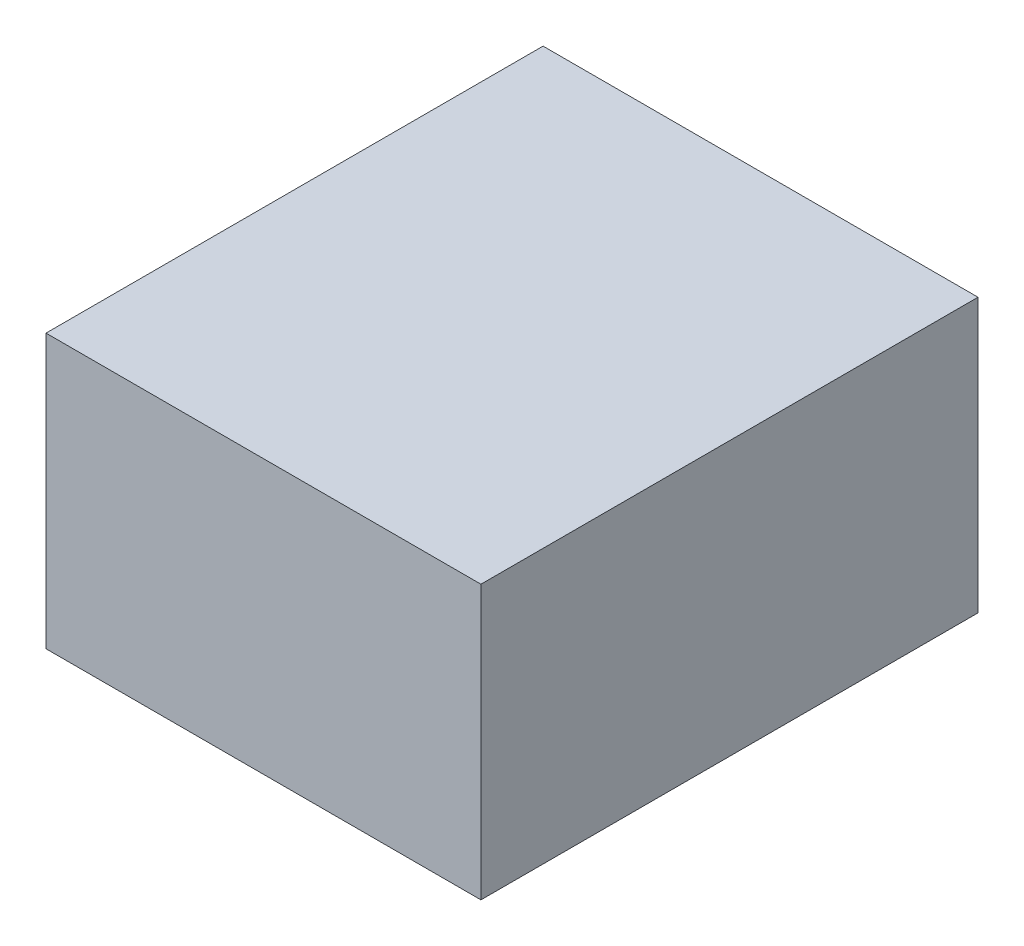
from build123d import *

# Parameters (mm, degrees)
SCHIZZO1_W                   = 1.75
SCHIZZO1_H                   = 2
ESTRUSIONE_ESTRUSIONE1_DEPTH = 1.1


with BuildPart() as part:
    # Schizzo1 → Estrusione-Estrusione1 (new body)
    with BuildSketch(Plane(origin=(0, 0, 0), x_dir=(1, 0, 0), z_dir=(0, 1, 0))):
        with Locations((-1.832805461, -8.477319114)):
            Rectangle(SCHIZZO1_W, SCHIZZO1_H)
    extrude(amount=ESTRUSIONE_ESTRUSIONE1_DEPTH)


solid = part.part
